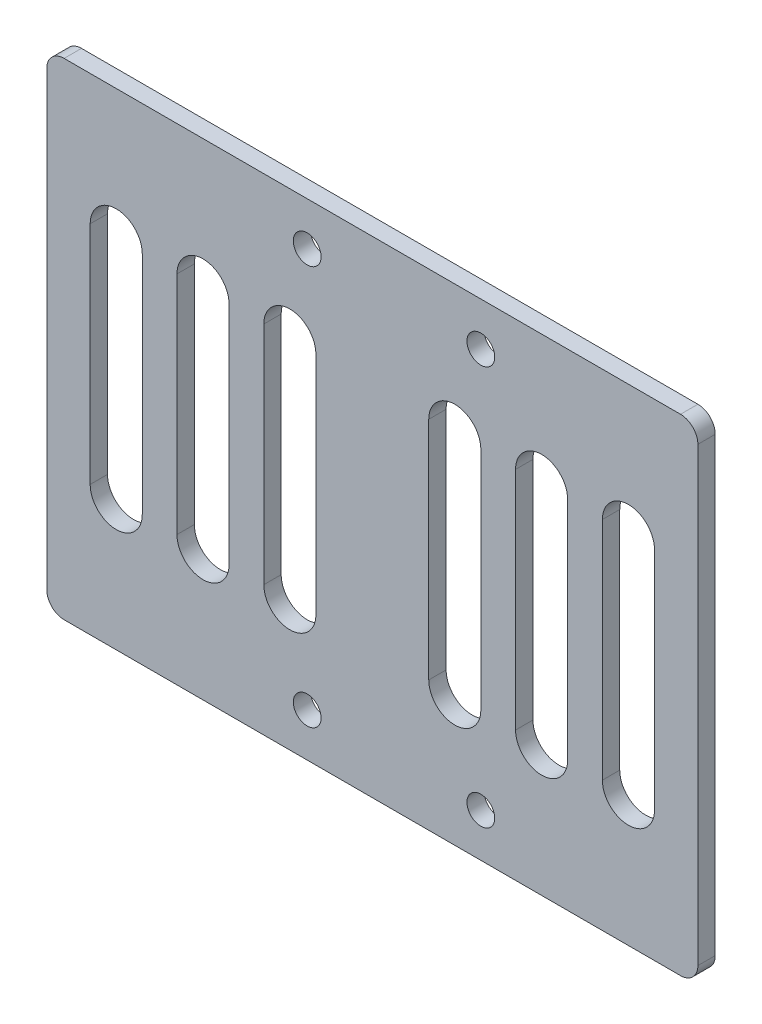
from build123d import *

# Parameters (mm, degrees)
SKETCH_1_W      = 75
SKETCH_1_H      = 56
SKETCH_1_R      = 1.6
EXTRUDE_1_DEPTH = 2
FILLET_1_R      = 2


with BuildPart() as part:
    # 草图1 → 凸台-拉伸1 (new body)
    with BuildSketch(Plane.XY):
        Rectangle(SKETCH_1_W, SKETCH_1_H)
        with Locations((12.5, 23)):
            Circle(SKETCH_1_R, mode=Mode.SUBTRACT)
        with Locations((-7.5, 23)):
            Circle(SKETCH_1_R, mode=Mode.SUBTRACT)
        with Locations(Location((-7.5, -23, 0), (0, 0, 180))):
            Circle(SKETCH_1_R, mode=Mode.SUBTRACT)
        with Locations(Location((12.5, -23, 0), (0, 0, 180))):
            Circle(SKETCH_1_R, mode=Mode.SUBTRACT)
        with BuildLine():
            Line((32.5, 13), (32.5, -13))
            ThreePointArc((32.5, -13), (29.5, -16), (26.5, -13))
            Line((26.5, -13), (26.5, 13))
            ThreePointArc((26.5, 13), (29.5, 16), (32.5, 13))
        make_face(mode=Mode.SUBTRACT)
        with BuildLine():
            Line((22.5, 13), (22.5, -13))
            ThreePointArc((22.5, -13), (19.5, -16), (16.5, -13))
            Line((16.5, -13), (16.5, 13))
            ThreePointArc((16.5, 13), (19.5, 16), (22.5, 13))
        make_face(mode=Mode.SUBTRACT)
        with BuildLine():
            Line((12.5, 13), (12.5, -13))
            ThreePointArc((12.5, -13), (9.5, -16), (6.5, -13))
            Line((6.5, -13), (6.5, 13))
            ThreePointArc((6.5, 13), (9.5, 16), (12.5, 13))
        make_face(mode=Mode.SUBTRACT)
        with BuildLine():
            Line((-12.5, 13), (-12.5, -13))
            ThreePointArc((-12.5, -13), (-9.5, -16), (-6.5, -13))
            Line((-6.5, -13), (-6.5, 13))
            ThreePointArc((-6.5, 13), (-9.5, 16), (-12.5, 13))
        make_face(mode=Mode.SUBTRACT)
        with BuildLine():
            Line((-22.5, 13), (-22.5, -13))
            ThreePointArc((-22.5, -13), (-19.5, -16), (-16.5, -13))
            Line((-16.5, -13), (-16.5, 13))
            ThreePointArc((-16.5, 13), (-19.5, 16), (-22.5, 13))
        make_face(mode=Mode.SUBTRACT)
        with BuildLine():
            Line((-32.5, 13), (-32.5, -13))
            ThreePointArc((-32.5, -13), (-29.5, -16), (-26.5, -13))
            Line((-26.5, -13), (-26.5, 13))
            ThreePointArc((-26.5, 13), (-29.5, 16), (-32.5, 13))
        make_face(mode=Mode.SUBTRACT)
    extrude(amount=EXTRUDE_1_DEPTH)

    # 圆角1
    fillet_1_edges = [part.edges().sort_by_distance(p)[0] for p in [
        (-37.5, 28, 1),
        (37.5, 28, 1),
        (37.5, -28, 1),
        (-37.5, -28, 1),
    ]]
    fillet(fillet_1_edges, radius=FILLET_1_R)


solid = part.part
